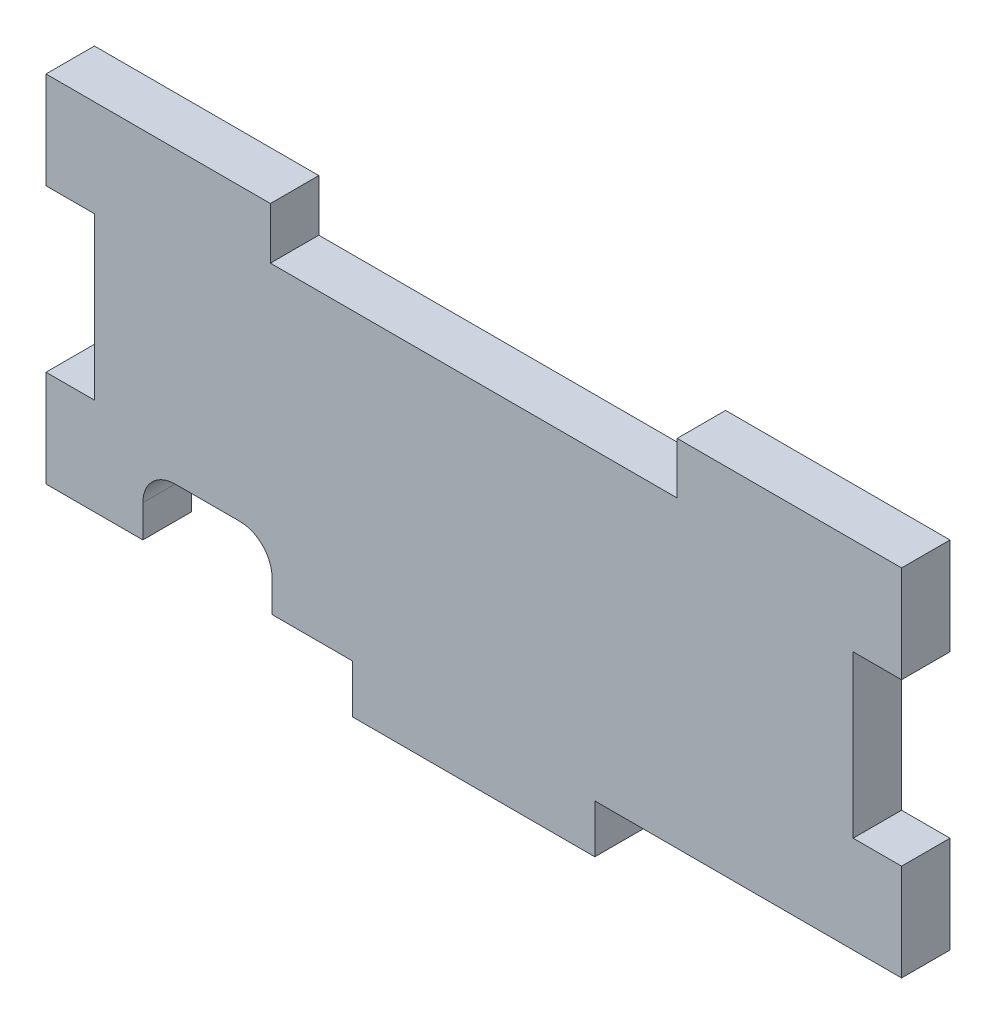
from build123d import *

# Parameters (mm, degrees)
BOSS_EXTRUDE1_DEPTH = 1.5
SKETCH2_W           = 3
SKETCH2_H           = 10
CUT_EXTRUDE1_DEPTH  = 56.865910894
SKETCH3_W           = 55
SKETCH3_H           = 25
CUT_EXTRUDE2_DEPTH  = 56.865910894
CUT_EXTRUDE3_DEPTH  = 56.865910894
SKETCH7_W           = 25.2
SKETCH7_H           = 3.2
CUT_EXTRUDE6_DEPTH  = 56.865910894


with BuildPart() as part:
    # Sketch1 → Boss-Extrude1 (new, symmetric)
    with BuildSketch(Plane.XY):
        Polygon((-20, -11), (20, -11), (20, -14), (35, -14), (35, -11), (54, -11), (54, 11), (-54, 11), (-54, -11), (-35, -11), (-35, -14), (-20, -14), align=None)
    extrude(amount=BOSS_EXTRUDE1_DEPTH, both=True)

    # Sketch2 → Cut-Extrude1 (cut, through all)
    with BuildSketch(Plane.XY.offset(1.5)):
        with Locations((2.5, 0)):
            Rectangle(SKETCH2_W, SKETCH2_H)
        with Locations((52.5, 0)):
            Rectangle(SKETCH2_W, SKETCH2_H)
    extrude(amount=-CUT_EXTRUDE1_DEPTH, mode=Mode.SUBTRACT)

    # Sketch3 → Cut-Extrude2 (cut, through all)
    with BuildSketch(Plane.XY.offset(1.5)):
        with Locations((-26.5, -1.5)):
            Rectangle(SKETCH3_W, SKETCH3_H)
    extrude(amount=-CUT_EXTRUDE2_DEPTH, mode=Mode.SUBTRACT)

    # Sketch4 → Cut-Extrude3 (cut, through all)
    with BuildSketch(Plane(origin=(0, 0, -1.5), x_dir=(-1, 0, 0), z_dir=(0, 0, -1))):
        with BuildLine():
            Line((-7, -11), (-7, -9))
            ThreePointArc((-7, -9), (-7.585786438, -7.585786438), (-9, -7))
            Line((-9, -7), (-13, -7))
            ThreePointArc((-13, -7), (-14.414213562, -7.585786438), (-15, -9))
            Line((-15, -9), (-15, -11))
            Line((-15, -11), (-7, -11))
        make_face()
    extrude(amount=-CUT_EXTRUDE3_DEPTH, mode=Mode.SUBTRACT)

    # Sketch7 → Cut-Extrude6 (cut, through all)
    with BuildSketch(Plane.XY.offset(1.5)):
        with Locations((27.5, 9.4)):
            Rectangle(SKETCH7_W, SKETCH7_H)
    extrude(amount=-CUT_EXTRUDE6_DEPTH, mode=Mode.SUBTRACT)


solid = part.part
